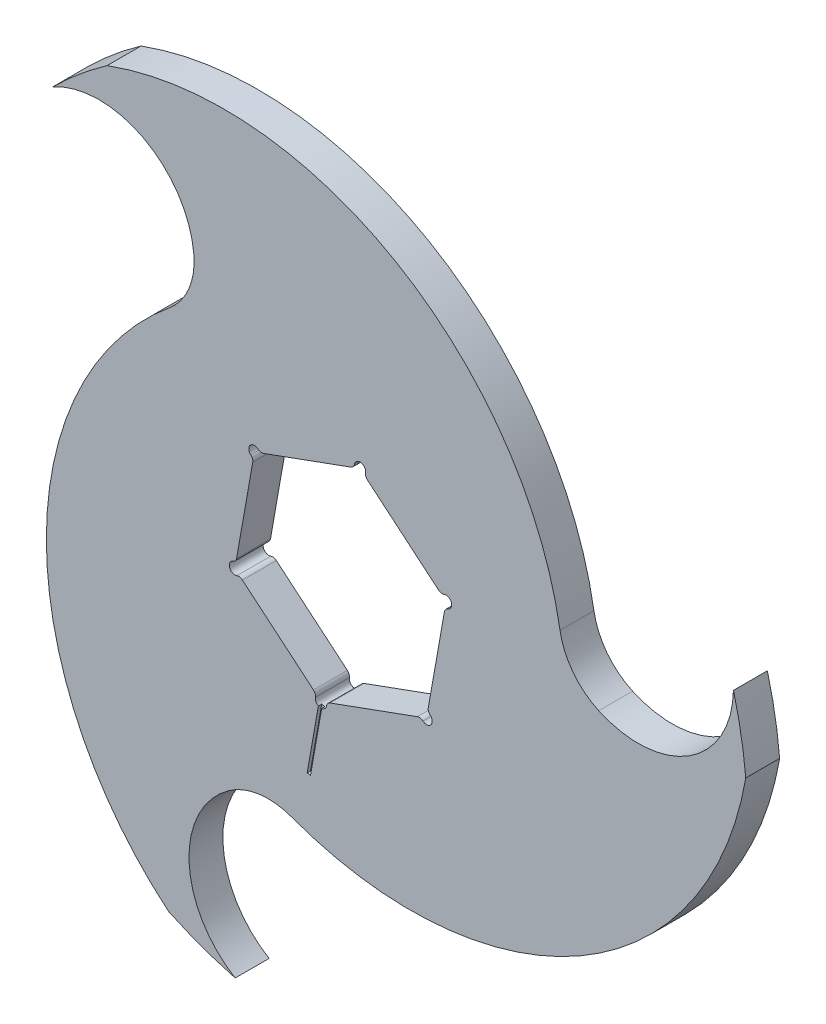
from build123d import *

# Parameters (mm, degrees)
BOSS_EXTRUDE1_DEPTH = 2.5
FILLET1_R           = 10
CUT_EXTRUDE1_DEPTH  = 0.5


with BuildPart() as part:
    # Sketch1 → Boss-Extrude1 (new, symmetric)
    with BuildSketch(Plane.XY):
        with BuildLine():
            ThreePointArc((-42.426406871, 42.426406871), (-26.29235792, 40.654943242), (-22.609103215, 24.847373735))
            ThreePointArc((-22.609103215, 24.847373735), (-43.353983992, -14.099744614), (-25.343982725, -54.38457998))
            ThreePointArc((-25.343982725, -54.38457998), (-20.514410827, -56.38403097), (-15.529142706, -57.955549577))
            ThreePointArc((-15.529142706, -57.955549577), (-22.062034677, -43.097321505), (-10.213905264, -32.003744609))
            ThreePointArc((-10.213905264, -32.003744609), (33.887729018, -30.495779185), (59.7704192, 5.243757117))
            ThreePointArc((59.7704192, 5.243757117), (59.087208601, 10.426014565), (57.955549577, 15.529142706))
            ThreePointArc((57.955549577, 15.529142706), (48.354392597, 2.442378263), (32.82300848, 7.156370874))
            ThreePointArc((32.82300848, 7.156370874), (9.466254973, 44.595523799), (-34.426436475, 49.140822863))
            ThreePointArc((-34.426436475, 49.140822863), (-38.572797774, 45.958016405), (-42.426406871, 42.426406871))
        make_face()
        with BuildLine():
            Line((1.521012626, 15.824554357), (-11.336990739, 11.14462386))
            ThreePointArc((-11.336990739, 11.14462386), (-11.76671434, 11.107027916), (-12.157663867, 11.289330674))
            ThreePointArc((-12.157663867, 11.289330674), (-13.331690578, 11.186616647), (-13.22897655, 10.012589936))
            ThreePointArc((-13.22897655, 10.012589936), (-12.981555707, 9.659236353), (-12.943959764, 9.229512752))
            Line((-12.943959764, 9.229512752), (-15.320022748, -4.245810053))
            ThreePointArc((-15.320022748, -4.245810053), (-15.502325506, -4.63675958), (-15.855679089, -4.884180422))
            ThreePointArc((-15.855679089, -4.884180422), (-16.353739487, -5.952274392), (-15.285645517, -6.45033479))
            ThreePointArc((-15.285645517, -6.45033479), (-14.855921916, -6.412738847), (-14.46497239, -6.595041605))
            Line((-14.46497239, -6.595041605), (-3.983032008, -15.390433913))
            ThreePointArc((-3.983032008, -15.390433913), (-3.735611166, -15.743787496), (-3.698015222, -16.173511097))
            ThreePointArc((-3.698015222, -16.173511097), (-3.02204891, -17.138891039), (-2.056668967, -16.462924726))
            ThreePointArc((-2.056668967, -16.462924726), (-1.874366209, -16.071975199), (-1.521012626, -15.824554357))
            Line((-1.521012626, -15.824554357), (11.336990739, -11.14462386))
            ThreePointArc((11.336990739, -11.14462386), (11.76671434, -11.107027916), (12.157663867, -11.289330674))
            ThreePointArc((12.157663867, -11.289330674), (13.331690578, -11.186616647), (13.22897655, -10.012589936))
            ThreePointArc((13.22897655, -10.012589936), (12.981555707, -9.659236353), (12.943959764, -9.229512752))
            Line((12.943959764, -9.229512752), (15.320022748, 4.245810053))
            ThreePointArc((15.320022748, 4.245810053), (15.502325506, 4.63675958), (15.855679089, 4.884180422))
            ThreePointArc((15.855679089, 4.884180422), (16.353739487, 5.952274392), (15.285645517, 6.45033479))
            ThreePointArc((15.285645517, 6.45033479), (14.855921916, 6.412738847), (14.46497239, 6.595041605))
            Line((14.46497239, 6.595041605), (3.983032008, 15.390433913))
            ThreePointArc((3.983032008, 15.390433913), (3.735611166, 15.743787496), (3.698015222, 16.173511097))
            ThreePointArc((3.698015222, 16.173511097), (3.02204891, 17.138891039), (2.056668967, 16.462924726))
            ThreePointArc((2.056668967, 16.462924726), (1.874366209, 16.071975199), (1.521012626, 15.824554357))
        make_face(mode=Mode.SUBTRACT)
    extrude(amount=BOSS_EXTRUDE1_DEPTH, both=True)

    # Fillet1
    fillet1_edges = [part.edges().sort_by_distance(p)[0] for p in [
        (32.82300848, 7.156370874, 0),
        (-10.213905264, -32.003744609, 0),
        (-22.609103215, 24.847373735, 0),
    ]]
    fillet(fillet1_edges, radius=FILLET1_R)

    # Sketch2 → Cut-Extrude1 (cut)
    with BuildSketch(Plane.XY.offset(2.5)):
        Polygon((-3.181426759, -16.603075118), (-2.689022882, -16.689899207), (-4.425504659, -26.537976737), (-4.917908536, -26.451152648), align=None)
    extrude(amount=-CUT_EXTRUDE1_DEPTH, mode=Mode.SUBTRACT)


solid = part.part
